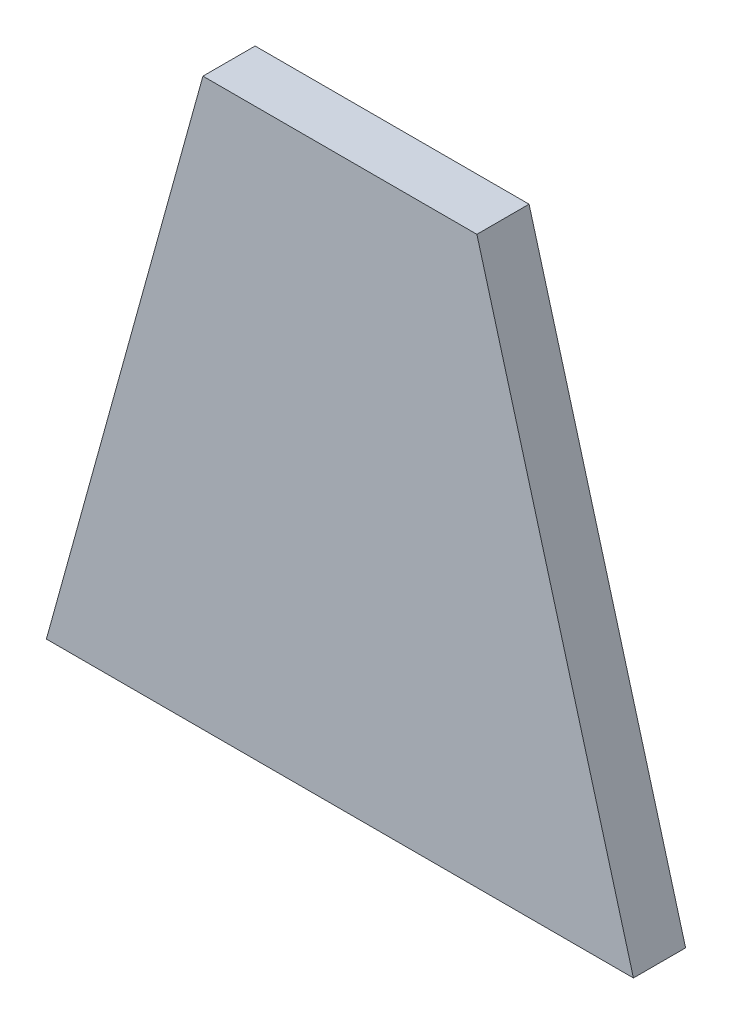
from build123d import *

# Parameters (mm, degrees)
BOSS_EXTRUDE1_DEPTH = 4


with BuildPart() as part:
    # Sketch1 → Boss-Extrude1 (new body)
    with BuildSketch(Plane.XY):
        Polygon((0, 0), (12, 43.370496884), (33, 43.370496884), (45, 0), align=None)
    extrude(amount=BOSS_EXTRUDE1_DEPTH)


solid = part.part
